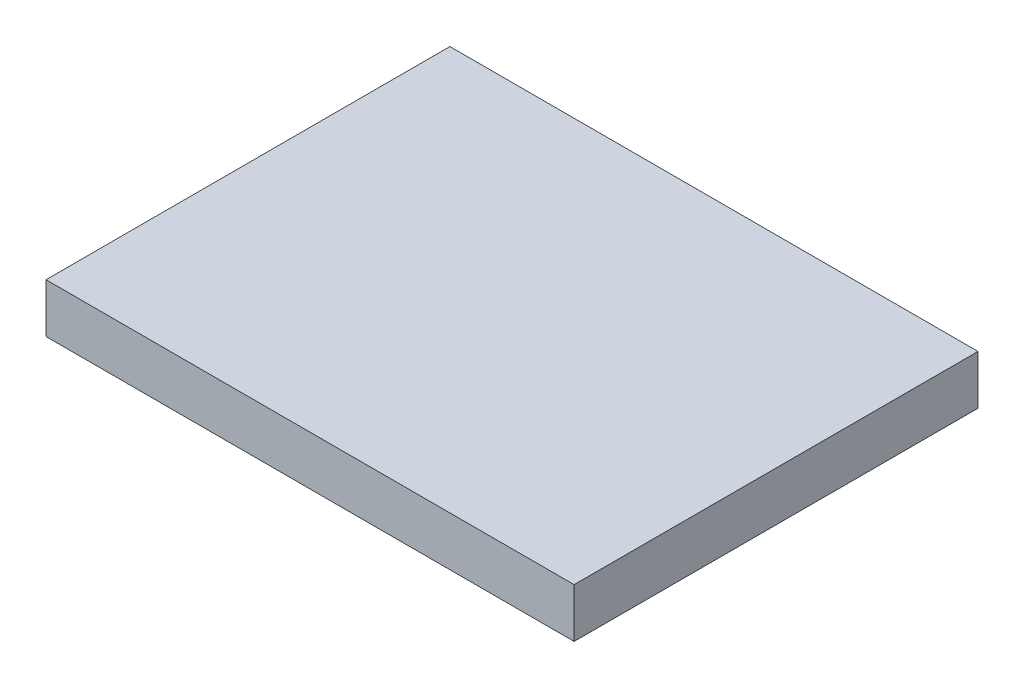
from build123d import *

# Parameters (mm, degrees)
SKETCH1_W           = 13.627802264
SKETCH1_H           = 10.42238962
BOSS_EXTRUDE1_DEPTH = 1.27


with BuildPart() as part:
    # Sketch1 → Boss-Extrude1 (new body)
    with BuildSketch(Plane(origin=(0, 0, 0), x_dir=(1, 0, 0), z_dir=(0, 1, 0))):
        Rectangle(SKETCH1_W, SKETCH1_H)
    extrude(amount=BOSS_EXTRUDE1_DEPTH)


solid = part.part
